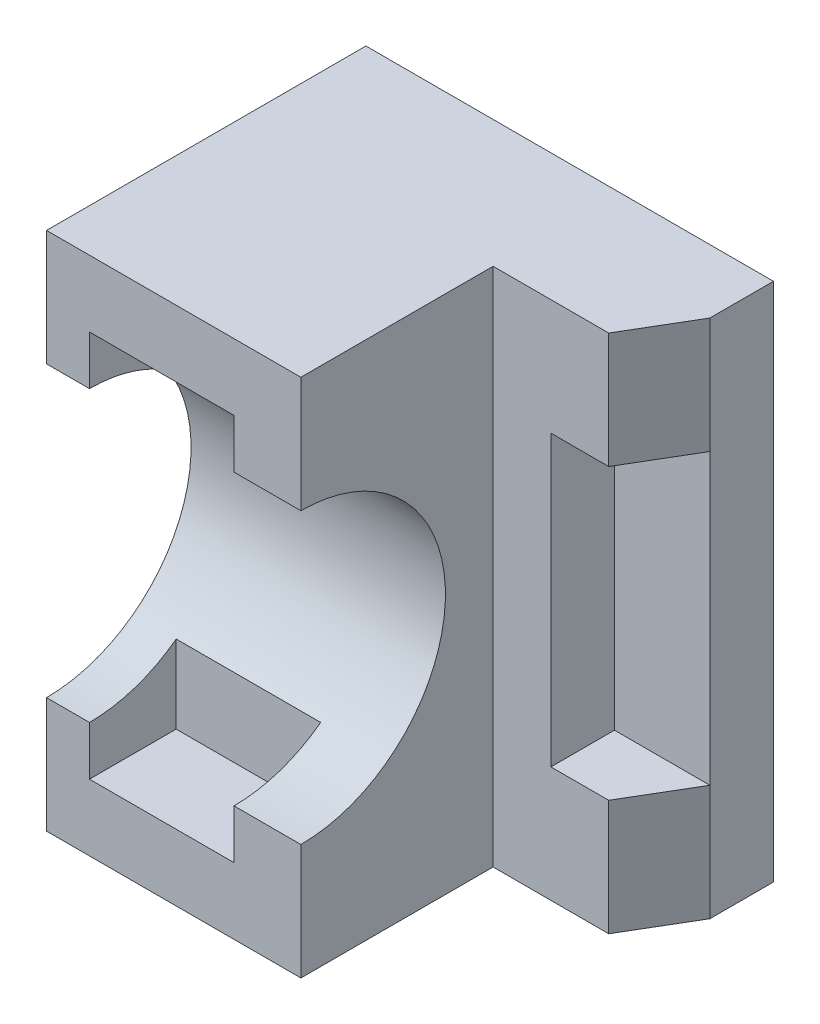
from build123d import *

# Parameters (mm, degrees)
SKETCH2_W           = 70.5
SKETCH2_H           = 90
BOSS_EXTRUDE1_DEPTH = 55.25
CUT_EXTRUDE2_DEPTH  = 112.333395709
CUT_EXTRUDE3_DEPTH  = 84.747014872
SKETCH8_W           = 25
SKETCH8_H           = 15
CUT_EXTRUDE4_DEPTH  = 15
SKETCH9_W           = 16.5
SKETCH9_H           = 50
CUT_EXTRUDE5_DEPTH  = 11


with BuildPart() as part:
    # Sketch2 → Boss-Extrude1 (new body)
    with BuildSketch(Plane.XY):
        Rectangle(SKETCH2_W, SKETCH2_H)
    extrude(amount=BOSS_EXTRUDE1_DEPTH)

    # Sketch4 → Cut-Extrude2 (cut, through all)
    with BuildSketch(Plane.XZ.offset(45)):
        Polygon((35.25, 55.25), (35.25, 22), (35.25, 11), (28.75, 22), (8.75, 22), (8.75, 55.25), align=None)
    extrude(amount=-CUT_EXTRUDE2_DEPTH, mode=Mode.SUBTRACT)

    # Sketch7 → Cut-Extrude3 (cut, through all)
    with BuildSketch(Plane(origin=(8.75, 0, 0), x_dir=(0, 0, -1), z_dir=(1, 0, 0))):
        with BuildLine():
            Line((-55.25, 25), (-55.25, -25))
            ThreePointArc((-55.25, -25), (-30.25, 0), (-55.25, 25))
        make_face()
    extrude(amount=-CUT_EXTRUDE3_DEPTH, mode=Mode.SUBTRACT)

    # Sketch8 → Cut-Extrude4 (cut)
    with BuildSketch(Plane.XY.offset(55.25)):
        with Locations((-15.323497595, 26)):
            Rectangle(SKETCH8_W, SKETCH8_H)
        with Locations((-15.323497595, -26)):
            Rectangle(SKETCH8_W, SKETCH8_H)
    extrude(amount=-CUT_EXTRUDE4_DEPTH, mode=Mode.SUBTRACT)

    # Sketch9 → Cut-Extrude5 (cut)
    with BuildSketch(Plane.XY.offset(22)):
        with Locations((27, 0)):
            Rectangle(SKETCH9_W, SKETCH9_H)
    extrude(amount=-CUT_EXTRUDE5_DEPTH, mode=Mode.SUBTRACT)


solid = part.part
